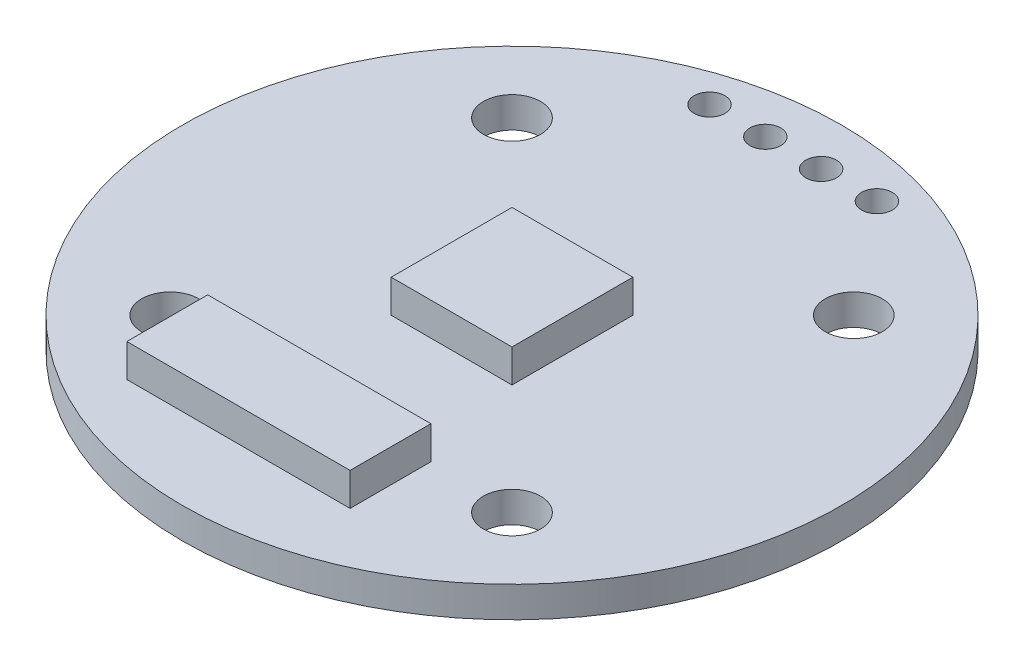
from build123d import *

# Parameters (mm, degrees)
SKETCH_1_R      = 15
SKETCH_1_R_2    = 1.3
SKETCH_1_R_3    = 0.7
EXTRUDE_2_DEPTH = 1.4
SKETCH_2_W      = 5.5
SKETCH_2_H      = 5.5
SKETCH_2_W_2    = 10.16
SKETCH_2_H_2    = 3.68
EXTRUDE_5_DEPTH = 1.5
SKETCH_3_W      = 5
SKETCH_3_H      = 3.37
EXTRUDE_7_DEPTH = 1.5


with BuildPart() as part:
    # 草图1 → 凸台-拉伸2 (new body)
    with BuildSketch(Plane(origin=(0, 0, 0), x_dir=(1, 0, 0), z_dir=(0, 1, 0))):
        with Locations(Location((0, 0, 0), (0, 0, 270))):
            Circle(SKETCH_1_R)
        with Locations(Location((-7.778174593, 7.778174593, 0), (0, 0, 270))):
            Circle(SKETCH_1_R_2, mode=Mode.SUBTRACT)
        with Locations(Location((7.778174593, 7.778174593, 0), (0, 0, 270))):
            Circle(SKETCH_1_R_2, mode=Mode.SUBTRACT)
        with Locations(Location((7.778174593, -7.778174593, 0), (0, 0, 270))):
            Circle(SKETCH_1_R_2, mode=Mode.SUBTRACT)
        with Locations(Location((-7.778174593, -7.778174593, 0), (0, 0, 270))):
            Circle(SKETCH_1_R_2, mode=Mode.SUBTRACT)
        with Locations(Location((-3.81, 12.8, 0), (0, 0, 270))):
            Circle(SKETCH_1_R_3, mode=Mode.SUBTRACT)
        with Locations(Location((-1.27, 12.8, 0), (0, 0, 270))):
            Circle(SKETCH_1_R_3, mode=Mode.SUBTRACT)
        with Locations(Location((1.27, 12.8, 0), (0, 0, 270))):
            Circle(SKETCH_1_R_3, mode=Mode.SUBTRACT)
        with Locations(Location((3.81, 12.8, 0), (0, 0, 270))):
            Circle(SKETCH_1_R_3, mode=Mode.SUBTRACT)
    extrude(amount=EXTRUDE_2_DEPTH)

    # 草图2 → 凸台-拉伸5 (add)
    with BuildSketch(Plane(origin=(0, 1.4, 0), x_dir=(1, 0, 0), z_dir=(0, 1, 0))):
        Rectangle(SKETCH_2_W, SKETCH_2_H)
        with Locations((-1.15, -9.46)):
            Rectangle(SKETCH_2_W_2, SKETCH_2_H_2)
    extrude(amount=EXTRUDE_5_DEPTH)

    # 草图3 → 凸台-拉伸7 (add)
    with BuildSketch(Plane.XZ):
        Rectangle(SKETCH_3_W, SKETCH_3_H)
    extrude(amount=EXTRUDE_7_DEPTH)


solid = part.part
